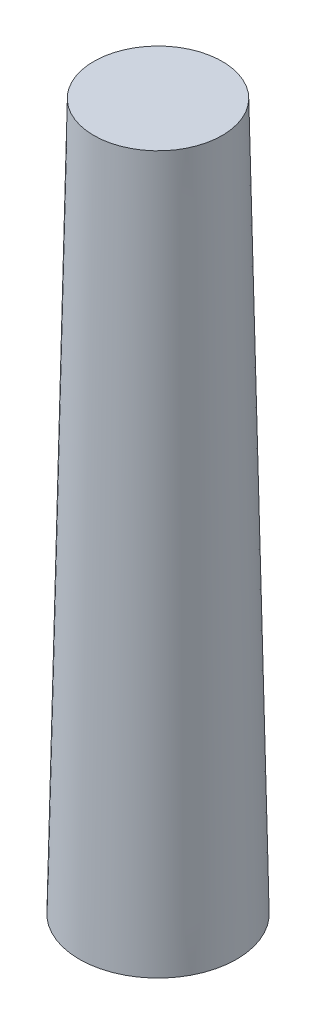
from build123d import *

# Parameters (mm, degrees)
SKETCH2_R = 1.524
SKETCH1_R = 1.8669


with BuildPart() as part:
    # Sketch2 → Loft1 section 0
    with BuildSketch(Plane(origin=(0, 16.764, 0), x_dir=(1, 0, 0), z_dir=(0, 1, 0))):
        Circle(SKETCH2_R)
    # Sketch1 → Loft1 section 1
    with BuildSketch(Plane(origin=(0, 0, 0), x_dir=(1, 0, 0), z_dir=(0, 1, 0))):
        Circle(SKETCH1_R)
    loft()


solid = part.part
